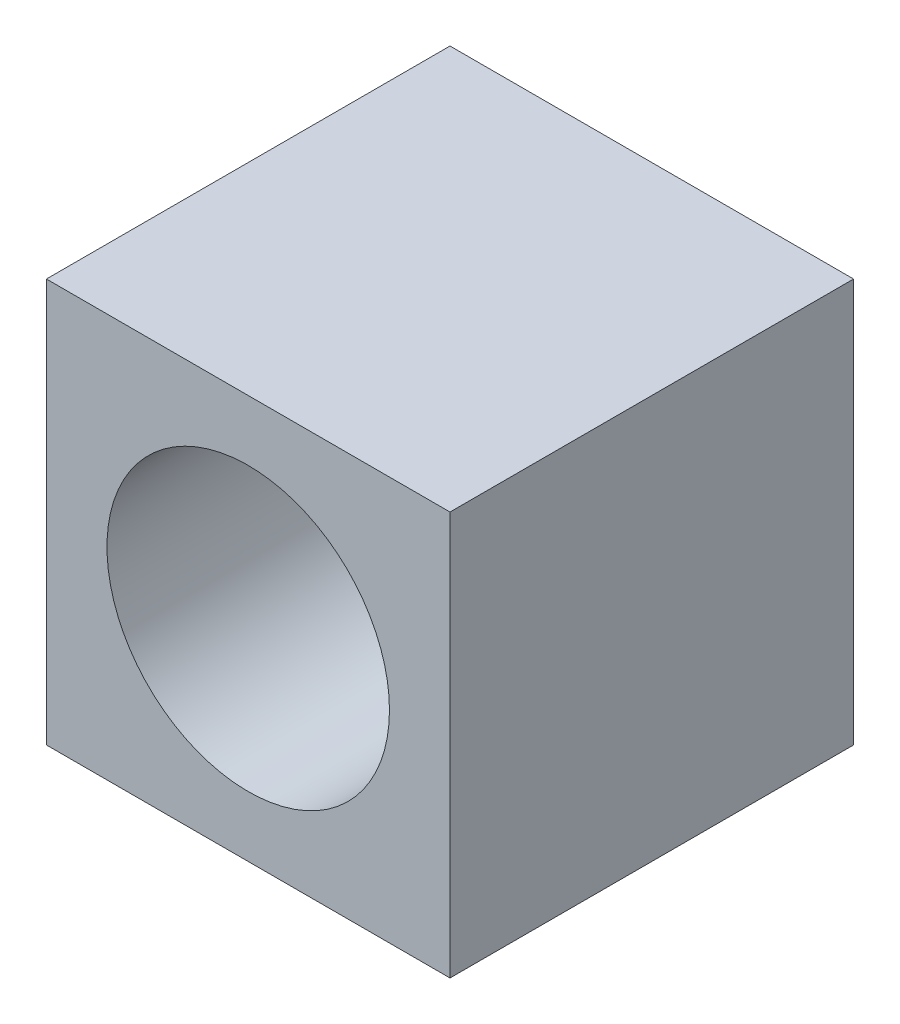
from build123d import *

# Parameters (mm, degrees)
SKETCH1_W           = 10
SKETCH1_H           = 10
BOSS_EXTRUDE1_DEPTH = 10
SKETCH2_R           = 3.5
CUT_EXTRUDE1_DEPTH  = 5


with BuildPart() as part:
    # Sketch1 → Boss-Extrude1 (new body)
    with BuildSketch(Plane.XY):
        Rectangle(SKETCH1_W, SKETCH1_H)
    extrude(amount=BOSS_EXTRUDE1_DEPTH)

    # Sketch2 → Cut-Extrude1 (cut)
    with BuildSketch(Plane.XY.offset(10)):
        Circle(SKETCH2_R)
    extrude(amount=-CUT_EXTRUDE1_DEPTH, mode=Mode.SUBTRACT)


solid = part.part
